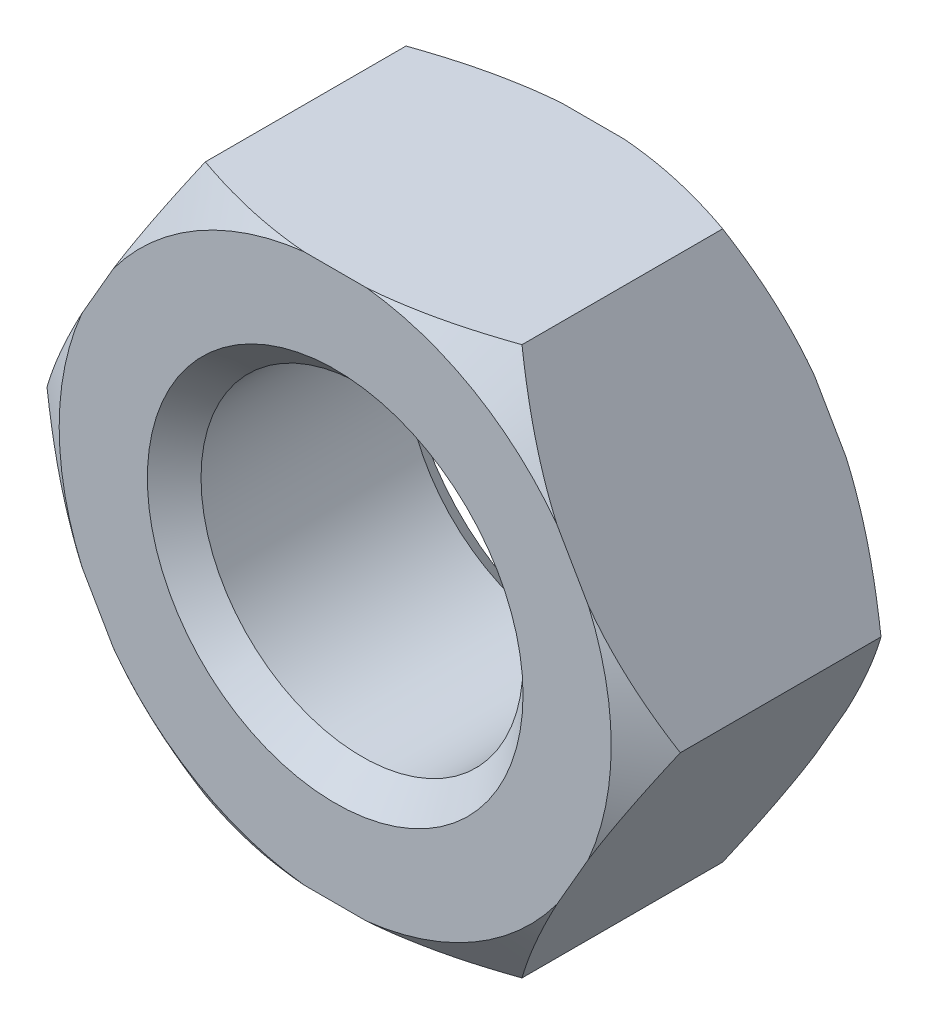
from build123d import *

# Parameters (mm, degrees)
SKETCH1_R           = 1.5
BOSS_EXTRUDE1_DEPTH = 2.4
CHAMFER1_SIZE       = 0.25


with BuildPart() as part:
    # Sketch1 → Boss-Extrude1 (new body)
    with BuildSketch(Plane.XY):
        Polygon((2.95, 0), (1.475, 2.554774941), (-1.475, 2.554774941), (-2.95, 0), (-1.475, -2.554774941), (1.475, -2.554774941), align=None)
        Circle(SKETCH1_R, mode=Mode.SUBTRACT)
    extrude(amount=BOSS_EXTRUDE1_DEPTH)

    # Chamfer1
    chamfer1_edges = [part.edges().sort_by_distance(p)[0] for p in [
        (-1.5, 0, 0),
        (-1.5, 0, 2.4),
    ]]
    chamfer(chamfer1_edges, length=CHAMFER1_SIZE)

    # Sketch2 → Cut-Revolve1 (revolve, cut)
    with BuildSketch(Plane(origin=(0, 0, 0), x_dir=(1, 0, 0), z_dir=(0, 1, 0))):
        Polygon((-1, -2.45), (-2.5, -2.45), (-3.132844885, -2.006877241), (-3.132844885, -0.393122759), (-2.5, 0.05), (-1, 0.05), (-1, 1.98132807), (-7.750900281, 1.98132807), (-7.750900281, -6.982873217), (-1, -6.982873217), align=None)
    revolve(axis=Axis((0, 0, 2.45), (0, 0, -1)), mode=Mode.SUBTRACT)


solid = part.part
